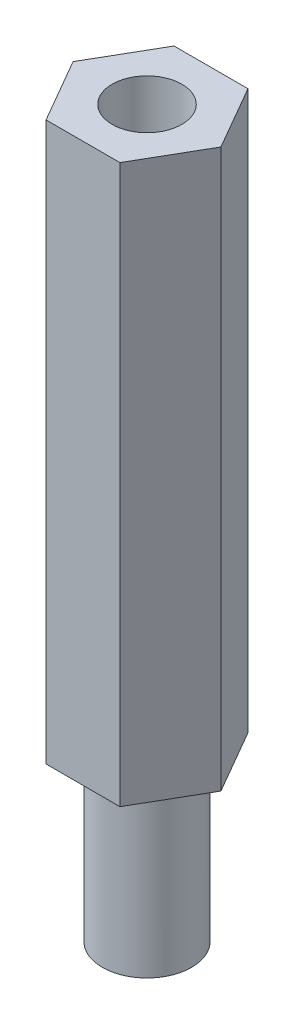
from build123d import *

# Parameters (mm, degrees)
EXTRUDE_1_DEPTH     = 20
SKETCH_6_R          = 1.6
EXTRUDE_2_DEPTH     = 6
SKETCH_7_R          = 1.25
CUT_EXTRUDE_1_DEPTH = 5


with BuildPart() as part:
    # 草图4 → 凸台-拉伸1 (new body)
    with BuildSketch(Plane(origin=(0, 0, 0), x_dir=(1, 0, 0), z_dir=(0, 1, 0))):
        Polygon((1.325, -2.29496732), (2.65, 0), (1.325, 2.29496732), (-1.325, 2.29496732), (-2.65, 0), (-1.325, -2.29496732), align=None)
    extrude(amount=EXTRUDE_1_DEPTH)

    # 草图6 → 凸台-拉伸2 (add)
    with BuildSketch(Plane(origin=(0, 0, 0), x_dir=(-1, 0, 0), z_dir=(0, -1, 0))):
        with Locations(Location((0, 0, 0), (0, 0, 270))):
            Circle(SKETCH_6_R)
    extrude(amount=EXTRUDE_2_DEPTH)

    # 草图7 → 切除-拉伸1 (cut)
    with BuildSketch(Plane(origin=(0, 20, 0), x_dir=(1, 0, 0), z_dir=(0, 1, 0))):
        with Locations(Location((0, 0, 0), (0, 0, 270))):
            Circle(SKETCH_7_R)
    extrude(amount=-CUT_EXTRUDE_1_DEPTH, mode=Mode.SUBTRACT)


solid = part.part
